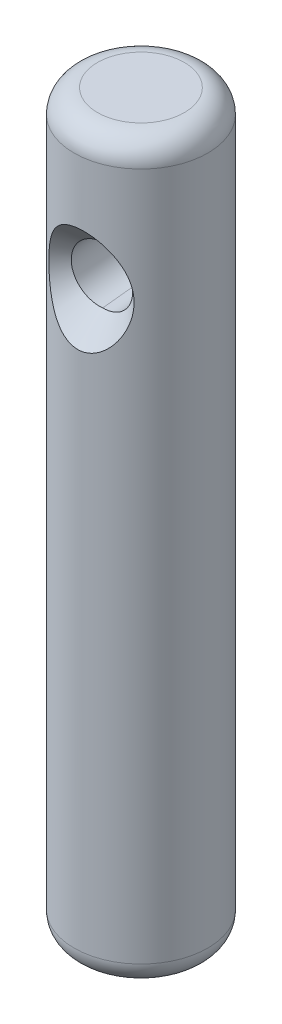
from build123d import *

# Parameters (mm, degrees)
SKETCH1_R           = 4
BOSS_EXTRUDE1_DEPTH = 44
FILLET3_R           = 1.4


with BuildPart() as part:
    # Sketch1 → Boss-Extrude1 (new body)
    with BuildSketch(Plane(origin=(0, 0, 0), x_dir=(1, 0, 0), z_dir=(0, 1, 0))):
        with Locations(Location((0, 0, 0), (0, 0, 270))):
            Circle(SKETCH1_R)
    extrude(amount=BOSS_EXTRUDE1_DEPTH)

    # Fillet3
    fillet3_edges = [part.edges().sort_by_distance(p)[0] for p in [
        (0, 0, -4),
        (0, 44, -4),
    ]]
    fillet(fillet3_edges, radius=FILLET3_R)

    # Sketch6 → CSK for M3 Oval Head Machine Screw1 (revolve, cut)
    with BuildSketch(Plane(origin=(0.311679131, 35.67179677, 3.987838527), x_dir=(0.9969596318094598, 0, -0.07791978274062668), z_dir=(0, 1, 0))):
        Polygon((0, 0), (0, 8), (1.725, 8), (1.7, 7.975), (1.7, 1.45), (3.15, 0), align=None)
    revolve(axis=Axis((0.806469751, 35.67179677, 10.318532189), (-0.07791978274062668, 0, -0.9969596318094597)), mode=Mode.SUBTRACT)

    # Sketch6 at point 2 (carried to point 2, square into its face) → CSK for M3 Oval Head Machine Screw1 at 2 (revolve, cut)
    with BuildSketch(Plane(origin=(-0.477245613, 35.67179677, -3.97142753), x_dir=(-0.992856932, 0, 0.119310992), z_dir=(0, 1, 0))):
        Polygon((0, 0), (0, 8), (1.725, 8), (1.7, 7.975), (1.7, 1.45), (3.15, 0), align=None)
    revolve(axis=Axis((-1.234870411, 35.67179677, -10.276069047), (0.119310992, 0, 0.992856932)), mode=Mode.SUBTRACT)


solid = part.part
